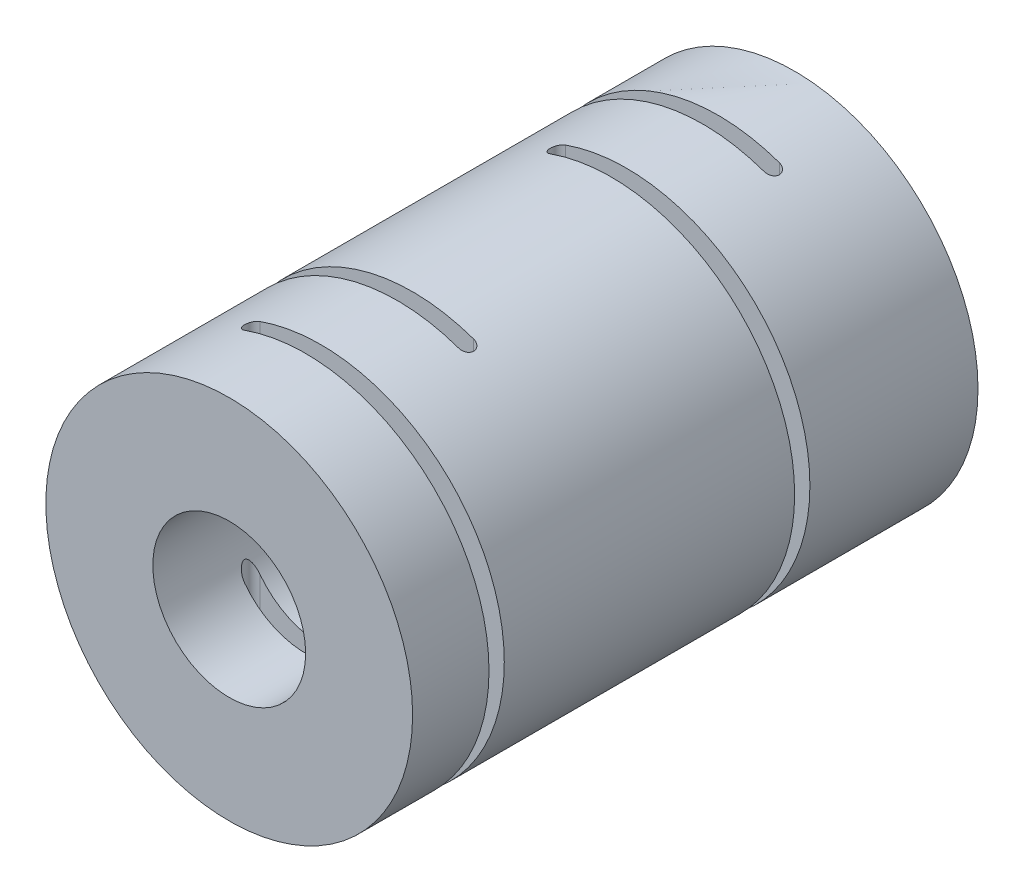
from build123d import *

# Parameters (mm, degrees)
SKETCH_1_R               = 6
SKETCH_1_R_2             = 2
EXTRUDE_1_DEPTH          = 9.25
SKETCH_2_R               = 6
SKETCH_2_R_2             = 2.5
EXTRUDE_2_DEPTH          = 9.25
CUT_EXTRUDE_1_DEPTH      = 10
CUT_EXTRUDE_1_DEPTH_BACK = 10


with BuildPart() as part:
    # 스케치1 → 보스-돌출1 (new body)
    with BuildSketch(Plane.XY):
        Circle(SKETCH_1_R)
        Circle(SKETCH_1_R_2, mode=Mode.SUBTRACT)
    extrude(amount=EXTRUDE_1_DEPTH)

    # 스케치2 → 보스-돌출2 (add)
    with BuildSketch(Plane.XY.offset(9.25)):
        Circle(SKETCH_2_R)
        Circle(SKETCH_2_R_2, mode=Mode.SUBTRACT)
    extrude(amount=EXTRUDE_2_DEPTH)

    # 스케치3 → 컷-돌출1 (cut, two sides: drawn at the far end of the back side and taken through both)
    with BuildSketch(Plane(origin=(0, 0, 0), x_dir=(1, 0, 0), z_dir=(0, 1, 0)).offset(-CUT_EXTRUDE_1_DEPTH_BACK)):
        with BuildLine():
            Line((-6, -2.5), (2, -2.5))
            ThreePointArc((2, -2.5), (2.25, -2.75), (2, -3))
            Line((2, -3), (-6, -3))
            Line((-6, -3), (-6, -2.5))
        make_face()
        with BuildLine():
            Line((-6, -12.5), (2, -12.5))
            ThreePointArc((2, -12.5), (2.25, -12.75), (2, -13))
            Line((2, -13), (-6, -13))
            Line((-6, -13), (-6, -12.5))
        make_face()
        with BuildLine():
            Line((6, -6), (-2, -6))
            ThreePointArc((-2, -6), (-2.25, -5.75), (-2, -5.5))
            Line((-2, -5.5), (6, -5.5))
            Line((6, -5.5), (6, -6))
        make_face()
        with BuildLine():
            Line((6, -16), (-2, -16))
            ThreePointArc((-2, -16), (-2.25, -15.75), (-2, -15.5))
            Line((-2, -15.5), (6, -15.5))
            Line((6, -15.5), (6, -16))
        make_face()
    extrude(amount=CUT_EXTRUDE_1_DEPTH + CUT_EXTRUDE_1_DEPTH_BACK, mode=Mode.SUBTRACT)


solid = part.part
